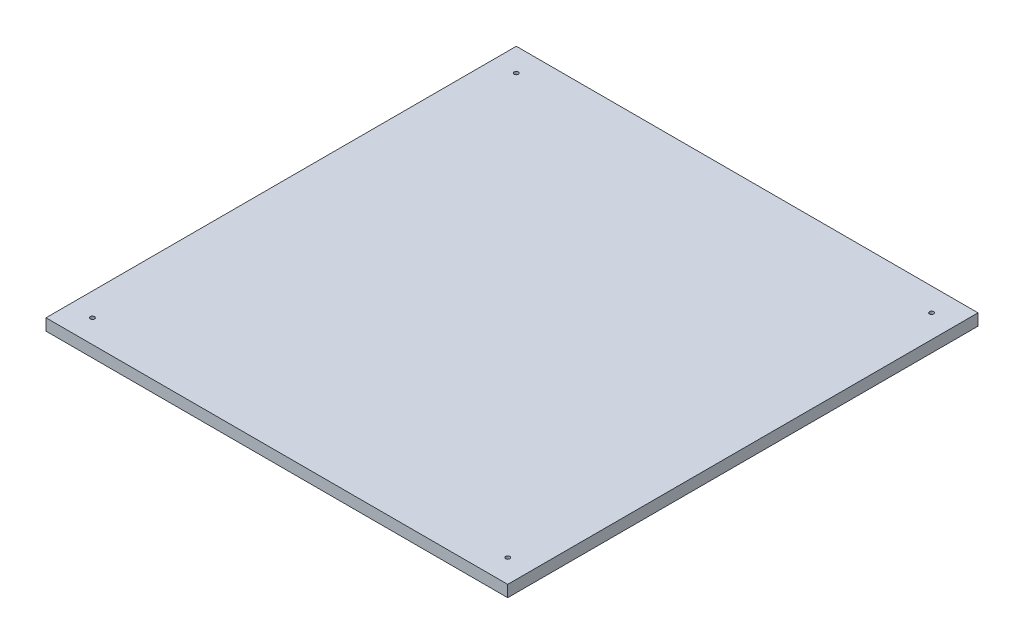
from build123d import *

# Parameters (mm, degrees)
SKETCH1_W               = 596.9
SKETCH1_H               = 608.0125
BOSS_EXTRUDE1_DEPTH     = 15
F_1_4_28_TAPPED_HOLE1_D = 5.4102


with BuildPart() as part:
    # Sketch1 → Boss-Extrude1 (new body)
    with BuildSketch(Plane(origin=(0, 0, 0), x_dir=(1, 0, 0), z_dir=(0, 1, 0))):
        Rectangle(SKETCH1_W, SKETCH1_H)
    extrude(amount=BOSS_EXTRUDE1_DEPTH)

    # 1/4-28 Tapped Hole1 (through all)
    with Locations(Plane(origin=(-268.45, 15, 274.00625), x_dir=(0, 0, 1), z_dir=(0, 1, 0))):
        with Locations((0, 0), (-548.0125, 0), (-548.0125, 536.9), (0, 536.9)):
            Hole(F_1_4_28_TAPPED_HOLE1_D / 2)


solid = part.part
